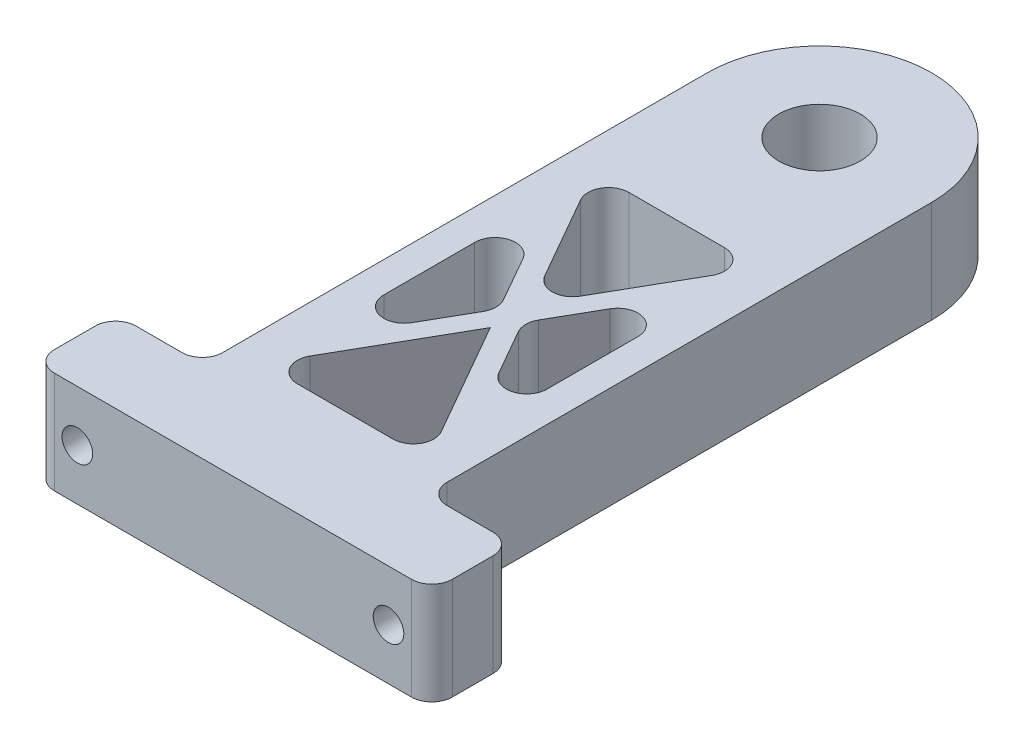
from build123d import *

# Parameters (mm, degrees)
SKETCH1_R           = 4
BOSS_EXTRUDE1_DEPTH = 10
FILLET1_R           = 2
SKETCH2_R           = 1.5
CUT_EXTRUDE1_DEPTH  = 65.346717088


with BuildPart() as part:
    # Sketch1 → Boss-Extrude1 (new body)
    with BuildSketch(Plane(origin=(0, 0, 0), x_dir=(1, 0, 0), z_dir=(0, 1, 0))):
        with BuildLine():
            Line((19.5, -49.5), (11, -49.5))
            Line((11, -49.5), (11, 0))
            ThreePointArc((11, 0), (0, 11), (-11, 0))
            Line((-11, 0), (-11, -49.5))
            Line((-11, -49.5), (-19.5, -49.5))
            Line((-19.5, -49.5), (-19.5, -57.5))
            Line((-19.5, -57.5), (19.5, -57.5))
            Line((19.5, -57.5), (19.5, -49.5))
        make_face()
        Polygon((0, -32.265564437), (8.133963179, -46.5), (-8.133963179, -46.5), align=None, mode=Mode.SUBTRACT)
        Polygon((-8, -42.234435563), (-8, -18.265564437), (-1.151751107, -30.25), align=None, mode=Mode.SUBTRACT)
        Polygon((8, -18.265564437), (8, -42.234435563), (1.151751107, -30.25), align=None, mode=Mode.SUBTRACT)
        Polygon((0, -28.234435563), (-8.133963179, -14), (8.133963179, -14), align=None, mode=Mode.SUBTRACT)
        with Locations(Location((0, 0, 0), (0, 0, 270))):
            Circle(SKETCH1_R, mode=Mode.SUBTRACT)
    extrude(amount=BOSS_EXTRUDE1_DEPTH)

    # Fillet1
    fillet1_edges = [part.edges().sort_by_distance(p)[0] for p in [
        (8.133963179, 5, 14),
        (-8.133963179, 5, 14),
        (0, 5, 28.234435563),
        (8, 5, 18.265564437),
        (1.151751107, 5, 30.25),
        (8, 5, 42.234435563),
        (-1.151751107, 5, 30.25),
        (-8, 5, 18.265564437),
        (-8, 5, 42.234435563),
        (8.133963179, 5, 46.5),
        (-8.133963179, 5, 46.5),
        (11, 5, 49.5),
        (19.5, 5, 49.5),
        (19.5, 5, 57.5),
        (-19.5, 5, 57.5),
        (-19.5, 5, 49.5),
        (-11, 5, 49.5),
    ]]
    fillet(fillet1_edges, radius=FILLET1_R)

    # Sketch2 → Cut-Extrude1 (cut, through all)
    with BuildSketch(Plane(origin=(0, 0, 49.5), x_dir=(-1, 0, 0), z_dir=(0, 0, -1))):
        with Locations((-15.25, 5)):
            Circle(SKETCH2_R)
        with Locations((15.25, 5)):
            Circle(SKETCH2_R)
    extrude(amount=-CUT_EXTRUDE1_DEPTH, mode=Mode.SUBTRACT)


solid = part.part
